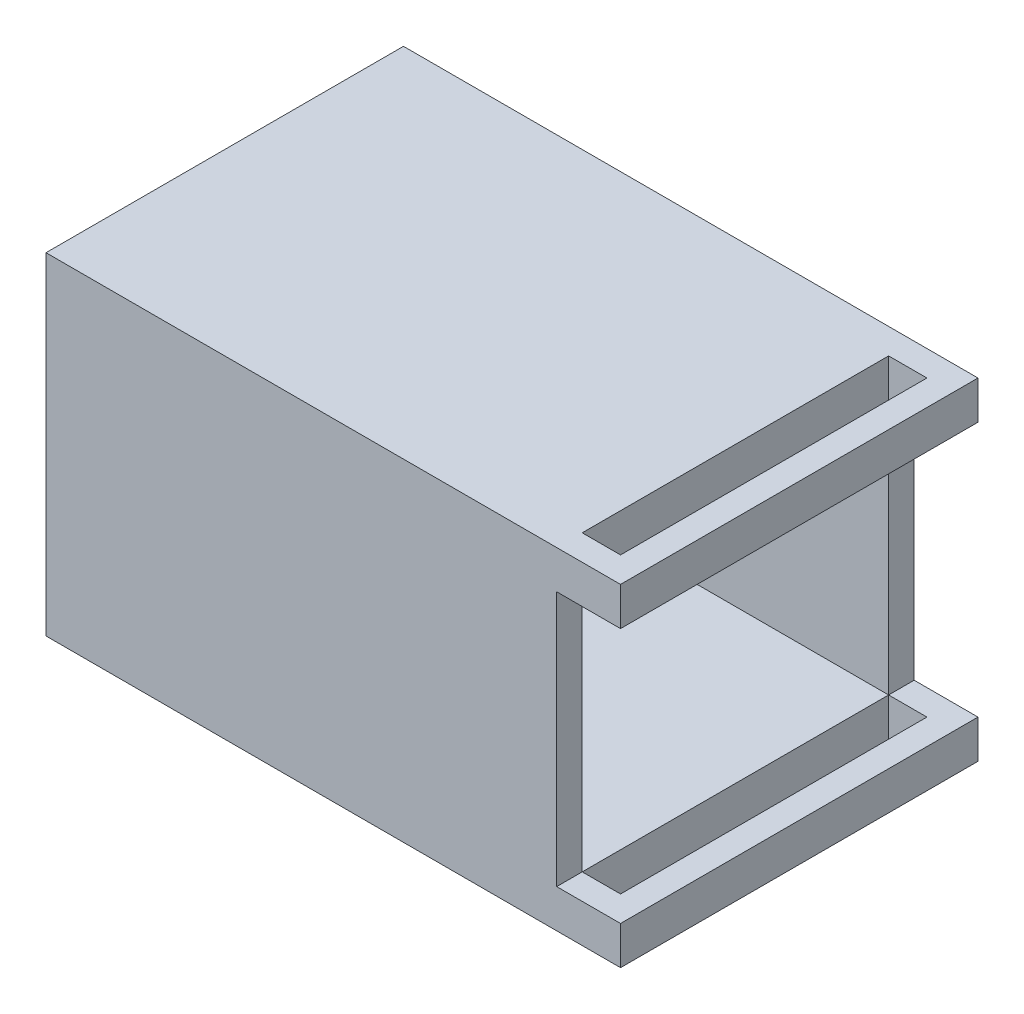
from build123d import *

# Parameters (mm, degrees)
SKETCH1_W           = 45
SKETCH1_H           = 28
BOSS_EXTRUDE1_DEPTH = 3
BOSS_EXTRUDE2_DEPTH = 22
SKETCH4_W           = 45
SKETCH4_H           = 28
SKETCH4_W_2         = 3
SKETCH4_H_2         = 24
BOSS_EXTRUDE4_DEPTH = 2
SKETCH5_W           = 9
SKETCH5_H           = 4
CUT_EXTRUDE1_DEPTH  = 2
SKETCH6_W           = 3
SKETCH6_H           = 24
CUT_EXTRUDE2_DEPTH  = 3
SKETCH7_W           = 45
SKETCH7_H           = 28
SKETCH7_W_2         = 3
SKETCH7_H_2         = 24
BOSS_EXTRUDE5_DEPTH = 1


with BuildPart() as part:
    # Sketch1 → Boss-Extrude1 (new body)
    with BuildSketch(Plane(origin=(0, 0, 0), x_dir=(1, 0, 0), z_dir=(0, 1, 0))):
        with Locations((22.5, 14)):
            Rectangle(SKETCH1_W, SKETCH1_H)
    extrude(amount=BOSS_EXTRUDE1_DEPTH)

    # Sketch2 → Boss-Extrude2 (add)
    with BuildSketch(Plane(origin=(0, 3, 0), x_dir=(1, 0, 0), z_dir=(0, 1, 0))):
        Polygon((40, 26), (40, 28), (0, 28), (0, 0), (40, 0), (40, 2), (2, 2), (2, 26), align=None)
    extrude(amount=BOSS_EXTRUDE2_DEPTH)

    # Sketch4 → Boss-Extrude4 (add)
    with BuildSketch(Plane(origin=(0, 25, 0), x_dir=(1, 0, 0), z_dir=(0, 1, 0))):
        with Locations((22.5, 14)):
            Rectangle(SKETCH4_W, SKETCH4_H)
        with Locations((41.5, 14)):
            Rectangle(SKETCH4_W_2, SKETCH4_H_2, mode=Mode.SUBTRACT)
    extrude(amount=-BOSS_EXTRUDE4_DEPTH)

    # Sketch5 → Cut-Extrude1 (cut)
    with BuildSketch(Plane.ZY):
        with BuildLine():
            Line((-18.72, 5.25), (-18.72, 6.16))
            ThreePointArc((-18.72, 6.16), (-18.353883476, 7.043883476), (-17.47, 7.41))
            Line((-17.47, 7.41), (-10.53, 7.41))
            ThreePointArc((-10.53, 7.41), (-9.646116524, 7.043883476), (-9.28, 6.16))
            Line((-9.28, 6.16), (-9.28, 5.25))
            ThreePointArc((-9.28, 5.25), (-9.646116524, 4.366116524), (-10.53, 4))
            Line((-10.53, 4), (-17.47, 4))
            ThreePointArc((-17.47, 4), (-18.353883476, 4.366116524), (-18.72, 5.25))
        make_face()
        with Locations((-14, 10.5)):
            Rectangle(SKETCH5_W, SKETCH5_H)
    extrude(amount=-CUT_EXTRUDE1_DEPTH, mode=Mode.SUBTRACT)

    # Sketch6 → Cut-Extrude2 (cut)
    with BuildSketch(Plane(origin=(0, 3, 0), x_dir=(1, 0, 0), z_dir=(0, 1, 0))):
        with Locations((41.5, 14)):
            Rectangle(SKETCH6_W, SKETCH6_H)
    extrude(amount=-CUT_EXTRUDE2_DEPTH, mode=Mode.SUBTRACT)

    # Sketch7 → Boss-Extrude5 (add)
    with BuildSketch(Plane(origin=(0, 25, 0), x_dir=(1, 0, 0), z_dir=(0, 1, 0))):
        with Locations((22.5, 14)):
            Rectangle(SKETCH7_W, SKETCH7_H)
        with Locations((41.5, 14)):
            Rectangle(SKETCH7_W_2, SKETCH7_H_2, mode=Mode.SUBTRACT)
    extrude(amount=BOSS_EXTRUDE5_DEPTH)


solid = part.part
